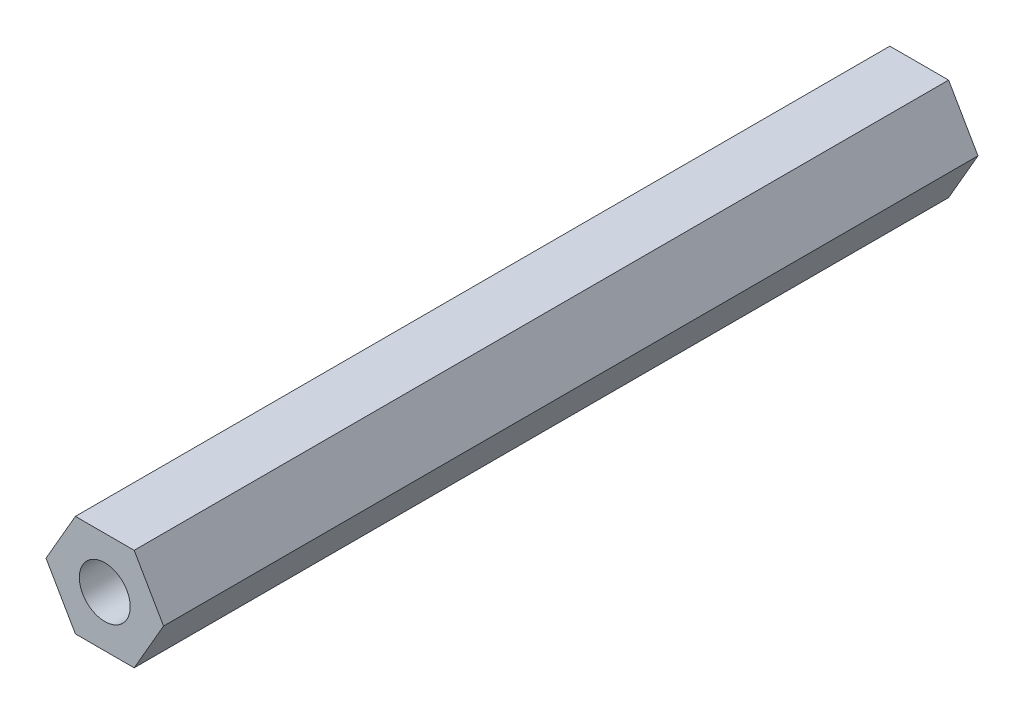
from build123d import *

# Parameters (mm, degrees)
SKETCH1_R           = 3.175
BOSS_EXTRUDE1_DEPTH = 101.6


with BuildPart() as part:
    # Sketch1 → Boss-Extrude1 (new body)
    with BuildSketch(Plane.XY):
        Polygon((3.666174209, 6.35), (-3.666174209, 6.35), (-7.332348419, 0), (-3.666174209, -6.35), (3.666174209, -6.35), (7.332348419, 0), align=None)
        Circle(SKETCH1_R, mode=Mode.SUBTRACT)
    extrude(amount=BOSS_EXTRUDE1_DEPTH)


solid = part.part
